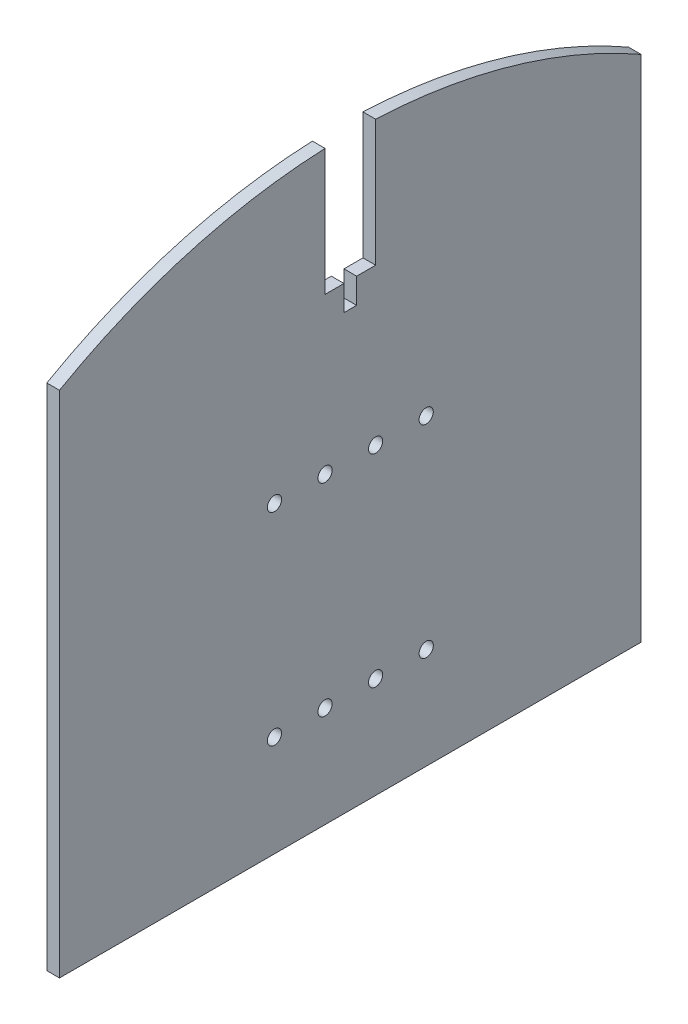
from build123d import *

# Parameters (mm, degrees)
BOSS_EXTRUDE1_DEPTH = 6.35
SKETCH2_R           = 3.5687
CUT_EXTRUDE1_DEPTH  = 149.606


with BuildPart() as part:
    # Sketch1 → Boss-Extrude1 (new body)
    with BuildSketch(Plane(origin=(0, 0, 0), x_dir=(0, 0, -1), z_dir=(1, 0, 0))):
        with BuildLine():
            Line((0, 0), (146.05, 0))
            Line((146.05, 0), (146.05, 255.602258394))
            ThreePointArc((146.05, 255.602258394), (81.677042764, 282.828530529), (12.7, 294.111929367))
            Line((12.7, 294.111929367), (12.7, 230.611929367))
            Line((12.7, 230.611929367), (3.175, 230.611929367))
            Line((3.175, 230.611929367), (3.175, 217.911929367))
            Line((3.175, 217.911929367), (-3.175, 217.911929367))
            Line((-3.175, 217.911929367), (-3.175, 230.611929367))
            Line((-3.175, 230.611929367), (-12.7, 230.611929367))
            Line((-12.7, 230.611929367), (-12.7, 294.111929367))
            ThreePointArc((-12.7, 294.111929367), (-81.677042764, 282.828530529), (-146.05, 255.602258394))
            Line((-146.05, 255.602258394), (-146.05, 0))
            Line((-146.05, 0), (0, 0))
        make_face()
    extrude(amount=BOSS_EXTRUDE1_DEPTH)

    # Sketch2 → Cut-Extrude1 (cut)
    with BuildSketch(Plane(origin=(0, 0, 0), x_dir=(0, 0, -1), z_dir=(1, 0, 0))):
        with Locations(Location((12.7, 50.8, 0), (0, 0, 180))):
            Circle(SKETCH2_R)
        with Locations(Location((38.1, 50.8, 0), (0, 0, 180))):
            Circle(SKETCH2_R)
        with Locations(Location((12.7, 152.4, 0), (0, 0, 180))):
            Circle(SKETCH2_R)
        with Locations(Location((38.1, 152.4, 0), (0, 0, 180))):
            Circle(SKETCH2_R)
        with Locations(Location((-12.7, 50.8, 0), (0, 0, 180))):
            Circle(SKETCH2_R)
        with Locations(Location((-38.1, 50.8, 0), (0, 0, 180))):
            Circle(SKETCH2_R)
        with Locations(Location((-38.1, 152.4, 0), (0, 0, 180))):
            Circle(SKETCH2_R)
        with Locations(Location((-12.7, 152.4, 0), (0, 0, 180))):
            Circle(SKETCH2_R)
    extrude(amount=CUT_EXTRUDE1_DEPTH, mode=Mode.SUBTRACT)


solid = part.part
